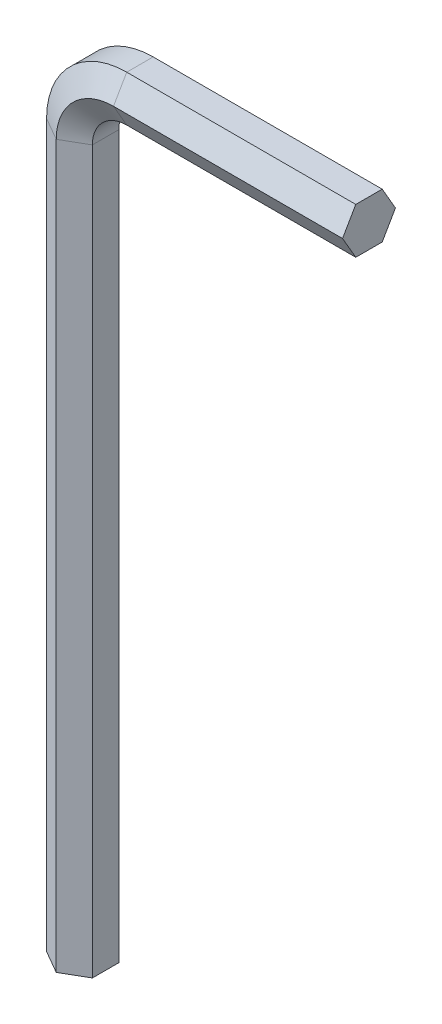
from build123d import *


with BuildPart() as part:
    # Sweep1: sweep along a path in Sketch2
    with BuildLine(Plane.XY) as sweep1_path:
        Line((0, 0), (0, 63))
        ThreePointArc((0, 63), (1.464466094, 66.535533906), (5, 68))
        Line((5, 68), (25, 68))
    # Sketch1 → Sweep1 (sweep)
    with BuildSketch(Plane(origin=(0, 0, 0), x_dir=(1, 0, 0), z_dir=(0, 1, 0))):
        Polygon((2, -1.154700538), (2, 1.154700538), (0, 2.309401077), (-2, 1.154700538), (-2, -1.154700538), (0, -2.309401077), align=None)
    sweep(path=sweep1_path.line)


solid = part.part
